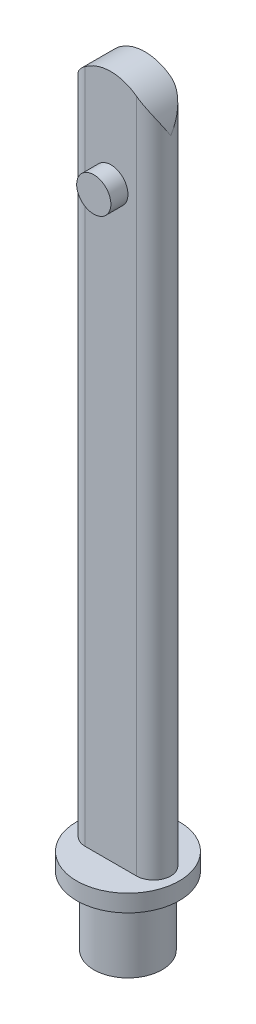
from build123d import *

# Parameters (mm, degrees)
BOSS_EXTRUDE1_DEPTH = 2000
CUT_EXTRUDE1_DEPTH  = 100
SKETCH9_R           = 50
BOSS_EXTRUDE2_DEPTH = 50
SKETCH10_W          = 0.943556428
SKETCH10_H          = 0.956350413
CUT_EXTRUDE2_DEPTH  = 1


with BuildPart() as part:
    # Sketch4 → Revolve1 (revolve)
    with BuildSketch(Plane.XY):
        Polygon((0, 250), (0, 0), (100, 0), (100, 200), (150, 200), (150, 250), align=None)
    revolve(axis=Axis((0, 250, 0), (0, -1, 0)))

    # Sketch7 → Boss-Extrude1 (add)
    with BuildSketch(Plane(origin=(0, 250, 0), x_dir=(1, 0, 0), z_dir=(0, 1, 0))):
        with BuildLine():
            Line((-75, 50), (75, 50))
            ThreePointArc((75, 50), (125, 0), (75, -50))
            Line((75, -50), (-75, -50))
            ThreePointArc((-75, -50), (-125, 0), (-75, 50))
        make_face()
    extrude(amount=BOSS_EXTRUDE1_DEPTH)

    # Sketch8 → Cut-Extrude1 (cut)
    with BuildSketch(Plane.XY.offset(50)):
        with BuildLine():
            Line((-125, 2124.5), (-125, 2250))
            Line((-125, 2250), (125, 2250))
            Line((125, 2250), (125, 2124.5))
            ThreePointArc((125, 2124.5), (0, 2249.5), (-125, 2124.5))
        make_face()
    extrude(amount=-CUT_EXTRUDE1_DEPTH, mode=Mode.SUBTRACT)

    # Sketch9 → Boss-Extrude2 (add)
    with BuildSketch(Plane.XY.offset(50)):
        with Locations((0, 1963.304019878)):
            Circle(SKETCH9_R)
    extrude(amount=BOSS_EXTRUDE2_DEPTH)

    # Sketch10 → Cut-Extrude2 (cut)
    with BuildSketch(Plane.XY.offset(100)):
        with Locations((0.471778214, 1962.825844672)):
            Rectangle(SKETCH10_W, SKETCH10_H)
    extrude(amount=-CUT_EXTRUDE2_DEPTH, mode=Mode.SUBTRACT)


solid = part.part
